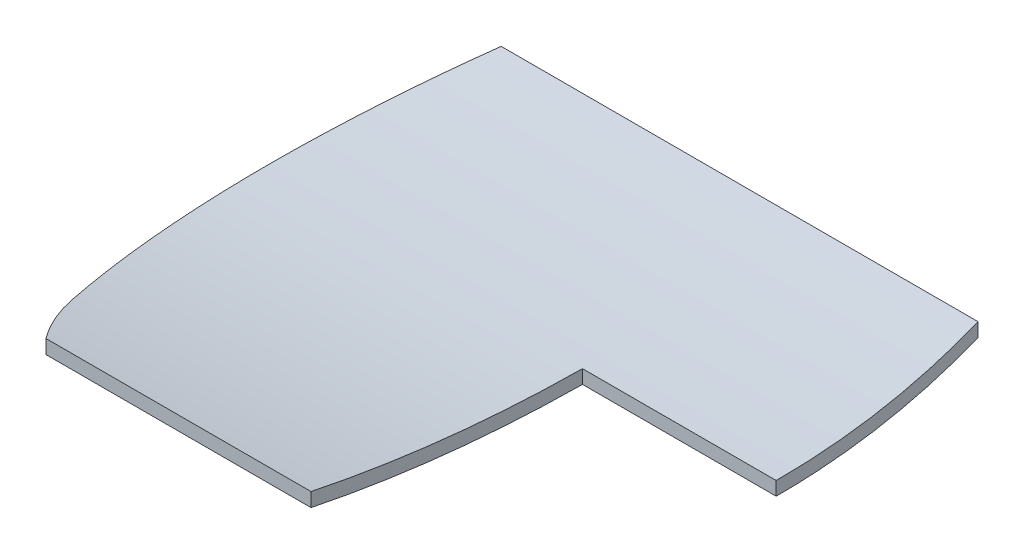
from build123d import *

# Parameters (mm, degrees)
SKETCH1_W               = 80
SKETCH1_H               = 75
BOSS_EXTRUDE1_DEPTH     = 30
CUT_EXTRUDE3_DEPTH      = 30
CUT_EXTRUDE4_DEPTH      = 46
CUT_EXTRUDE4_DEPTH_BACK = 53


with BuildPart() as part:
    # Sketch1 → Boss-Extrude1 (new body)
    with BuildSketch(Plane(origin=(0, 0, 0), x_dir=(1, 0, 0), z_dir=(0, 1, 0))):
        with Locations((-35.837742504, -33.866843034)):
            Rectangle(SKETCH1_W, SKETCH1_H)
    extrude(amount=BOSS_EXTRUDE1_DEPTH)

    # Sketch6 → Cut-Extrude3 (cut)
    with BuildSketch(Plane(origin=(0, 30, 0), x_dir=(1, 0, 0), z_dir=(0, 1, 0))):
        with BuildLine():
            Line((-71.375833468, 3.633156966), (-108.820806999, 13.42149107))
            Line((-108.820806999, 13.42149107), (-125.584570218, -100.370099881))
            Line((-125.584570218, -100.370099881), (-10.920024304, -107.668906036))
            Line((-10.920024304, -107.668906036), (16.042240316, -75.531910929))
            Line((16.042240316, -75.531910929), (16.042240316, -32.24724925))
            Line((16.042240316, -32.24724925), (13.170421527, 8.096312294))
            Line((13.170421527, 8.096312294), (0.934093701, 3.633156966))
            ThreePointArc((0.934093701, 3.633156966), (3.278926231, -13.213255463), (4.162257496, -30.199119503))
            Line((4.162257496, -30.199119503), (-25.2116582, -30.199119503))
            Line((-25.2116582, -30.199119503), (-25.2116582, -71.366843034))
            Line((-25.2116582, -71.366843034), (-65.403764634, -71.366843034))
            ThreePointArc((-65.403764634, -71.366843034), (-68.14206018, -67.273150859), (-70.111731546, -62.759064813))
            ThreePointArc((-70.111731546, -62.759064813), (-75.817600676, -29.659558964), (-71.375833468, 3.633156966))
        make_face()
    extrude(amount=-CUT_EXTRUDE3_DEPTH, mode=Mode.SUBTRACT)

    # Sketch7 → Cut-Extrude4 (cut, two sides: drawn at the far end of the back side and taken through both)
    with BuildSketch(Plane(origin=(-25.2116582, 0, 0), x_dir=(0, 0, -1), z_dir=(1, 0, 0)).offset(-CUT_EXTRUDE4_DEPTH_BACK)):
        with BuildLine():
            Line((3.633156966, 4.41216157), (25.866454997, 63.394578765))
            Line((25.866454997, 63.394578765), (-68.187233435, 84.334388308))
            Line((-68.187233435, 84.334388308), (-84.699418689, 46.854351889))
            Line((-84.699418689, 46.854351889), (-91.169251259, 32.168860137))
            Line((-91.169251259, 32.168860137), (-79.899921895, -15.478262788))
            Line((-79.899921895, -15.478262788), (10.487341479, -37.061233348))
            Line((10.487341479, -37.061233348), (3.633156966, 2.319452889))
            ThreePointArc((3.633156966, 2.319452889), (-33.958413843, 0.084026639), (-71.366843034, 4.41216157))
            Line((-71.366843034, 4.41216157), (-77.914841613, 5.869986833))
            Line((-77.914841613, 5.869986833), (-71.366843034, 6.525778375))
            ThreePointArc((-71.366843034, 6.525778375), (-33.960238488, 2.154907065), (3.633156966, 4.41216157))
        make_face()
    extrude(amount=CUT_EXTRUDE4_DEPTH + CUT_EXTRUDE4_DEPTH_BACK, mode=Mode.SUBTRACT)


solid = part.part
